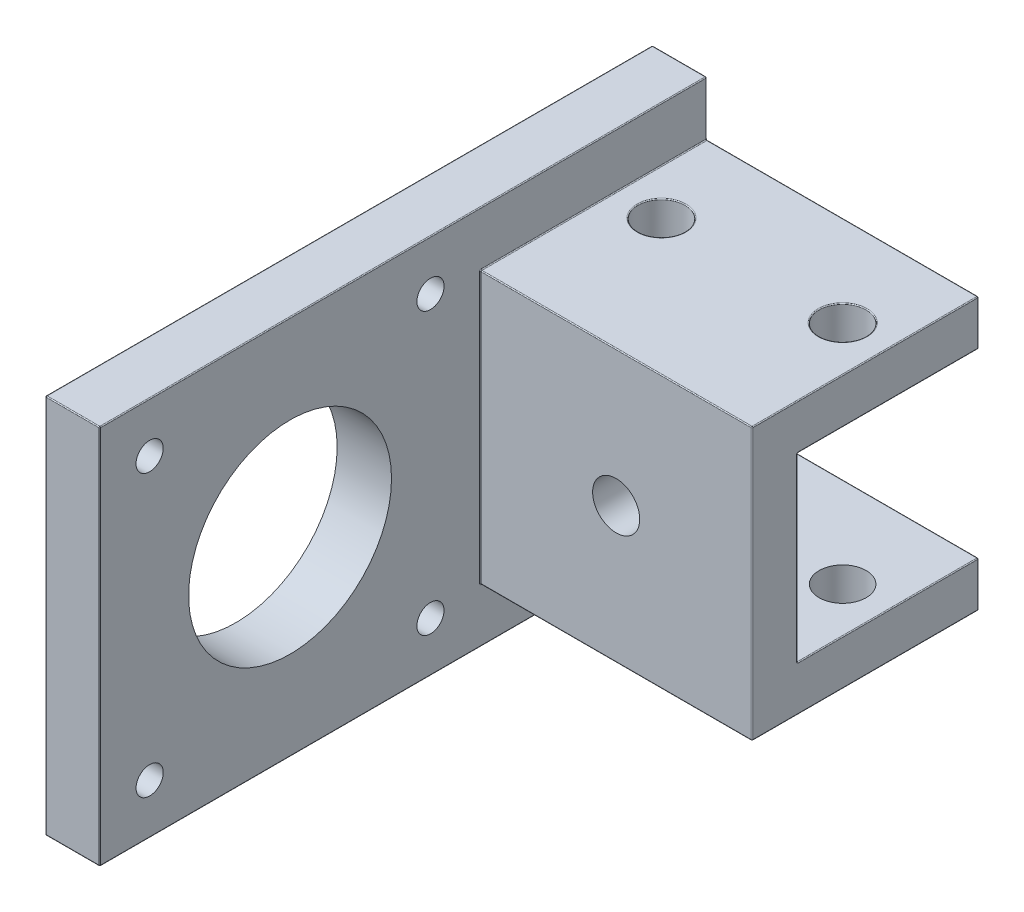
from build123d import *

# Parameters (mm, degrees)
SKETCH1_W           = 67
SKETCH1_H           = 41.999999434
BOSS_EXTRUDE1_DEPTH = 6.000000983
SKETCH2_W           = 24.999999441
SKETCH2_H           = 29.999998398
BOSS_EXTRUDE2_DEPTH = 29.999997467
SKETCH3_W           = 19.999999553
SKETCH3_H           = 19.999999553
CUT_EXTRUDE1_DEPTH  = 73.587876969
SKETCH14_R          = 11.2
CUT_EXTRUDE12_DEPTH = 10
SKETCH15_R          = 2.6
CUT_EXTRUDE13_DEPTH = 96.573055549
SKETCH18_R          = 1.5
CUT_EXTRUDE14_DEPTH = 70.806875324
SKETCH19_R          = 2.6
CUT_EXTRUDE15_DEPTH = 96.693306709
FILLET1_R           = 0.1


with BuildPart() as part:
    # Sketch1 → Boss-Extrude1 (new body)
    with BuildSketch(Plane(origin=(45.028056949, 0, 0), x_dir=(0, 0, -1), z_dir=(1, 0, 0))):
        with Locations((-13.500000447, 20.999999717)):
            Rectangle(SKETCH1_W, SKETCH1_H)
    extrude(amount=-BOSS_EXTRUDE1_DEPTH)

    # Sketch2 → Boss-Extrude2 (add)
    with BuildSketch(Plane(origin=(45.028056949, 0, 0), x_dir=(0, 0, -1), z_dir=(1, 0, 0))):
        with Locations((7.499999833, 20.999999251)):
            Rectangle(SKETCH2_W, SKETCH2_H)
    extrude(amount=BOSS_EXTRUDE2_DEPTH)

    # Sketch3 → Cut-Extrude1 (cut, through all)
    with BuildSketch(Plane.ZY.offset(-39.028055966)):
        with Locations((-9.999999777, 20.999999716)):
            Rectangle(SKETCH3_W, SKETCH3_H)
    extrude(amount=-CUT_EXTRUDE1_DEPTH, mode=Mode.SUBTRACT)

    # Sketch14 → Cut-Extrude12 (cut)
    with BuildSketch(Plane(origin=(45.028056949, 0, 0), x_dir=(0, 0, -1), z_dir=(1, 0, 0))):
        with Locations((-25.999999888, 20.999999251)):
            Circle(SKETCH14_R)
    extrude(amount=-CUT_EXTRUDE12_DEPTH, mode=Mode.SUBTRACT)

    # Sketch15 → Cut-Extrude13 (cut, through all)
    with BuildSketch(Plane(origin=(0, 6.000000052, 0), x_dir=(-1, 0, 0), z_dir=(0, -1, 0))):
        with Locations(Location((-50.028056949, 9.999999553, 0), (0, 0, 90))):
            Circle(SKETCH15_R)
        with Locations(Location((-70.028056949, 9.999999553, 0), (0, 0, 90))):
            Circle(SKETCH15_R)
    extrude(amount=-CUT_EXTRUDE13_DEPTH, mode=Mode.SUBTRACT)

    # Sketch18 → Cut-Extrude14 (cut, through all)
    with BuildSketch(Plane(origin=(45.028056949, 0, 0), x_dir=(0, 0, -1), z_dir=(1, 0, 0))):
        with Locations((-10.499999888, 36.499999251)):
            Circle(SKETCH18_R)
        with Locations((-10.499999888, 5.499999251)):
            Circle(SKETCH18_R)
        with Locations((-41.499999888, 5.499999251)):
            Circle(SKETCH18_R)
        with Locations((-41.499999888, 36.499999251)):
            Circle(SKETCH18_R)
    extrude(amount=-CUT_EXTRUDE14_DEPTH, mode=Mode.SUBTRACT)

    # Sketch19 → Cut-Extrude15 (cut, through all)
    with BuildSketch(Plane.XY.offset(4.999999888)):
        with Locations((60.028055683, 20.999999251)):
            Circle(SKETCH19_R)
    extrude(amount=-CUT_EXTRUDE15_DEPTH, mode=Mode.SUBTRACT)

    # Fillet1
    fillet1_edges = [part.edges().sort_by_distance(p)[0] for p in [
        (39.028055966, 5.49999997, -19.999999553),
        (45.028056949, 38.999998942, -19.999999553),
        (45.028056949, 35.99999845, -7.499999832),
        (39.028055966, 41.999999434, 13.500000447),
        (60.028055683, 35.99999845, -19.999999553),
        (45.028056949, 20.999999251, 4.999999888),
        (60.028055683, 35.99999845, 4.999999888),
        (45.028056949, 6.000000052, -7.499999832),
        (60.028055683, 6.000000052, 4.999999888),
        (60.028055683, 6.000000052, -19.999999553),
        (75.028054416, 35.99999845, -7.499999832),
        (75.028054416, 20.999999251, 4.999999888),
        (75.028054416, 6.000000052, -7.499999832),
        (75.028054416, 8.499999996, -19.999999553),
        (75.028054416, 33.499998972, -19.999999553),
        (39.028055966, 36.499999464, -19.999999553),
        (75.028054416, 30.999999493, -9.999999776),
        (57.028055191, 30.999999493, -19.999999553),
        (75.028054416, 20.999999717, 0),
        (57.028055191, 30.999999493, 0),
        (75.028054416, 10.99999994, -9.999999776),
        (57.028055191, 10.99999994, 0),
        (57.028055191, 10.99999994, -19.999999553),
        (39.028055966, 30.999999493, -9.999999776),
        (39.028055966, 10.99999994, -9.999999776),
        (39.028055966, 20.999999717, 0),
        (39.028055966, 20.999999717, 47.000000447),
        (45.028056949, 41.999999434, 13.500000447),
        (45.028056949, 3.000000026, -19.999999553),
        (50.028056949, 30.999999493, -7.399999553),
        (50.028056949, 35.99999845, -7.399999553),
        (50.028056949, 6.000000052, -7.399999553),
        (45.028056949, 0, 13.500000447),
        (70.028056949, 30.999999493, -7.399999553),
        (70.028056949, 35.99999845, -7.399999553),
        (70.028056949, 6.000000052, -7.399999553),
        (45.028056949, 20.999999717, 47.000000447),
        (42.028056458, 41.999999434, 47.000000447),
        (42.028056458, 41.999999434, -19.999999553),
        (42.028056458, 0, -19.999999553),
        (42.028056458, 0, 47.000000447),
        (39.028055966, 0, 13.500000447),
    ]]
    fillet(fillet1_edges, radius=FILLET1_R)


solid = part.part
